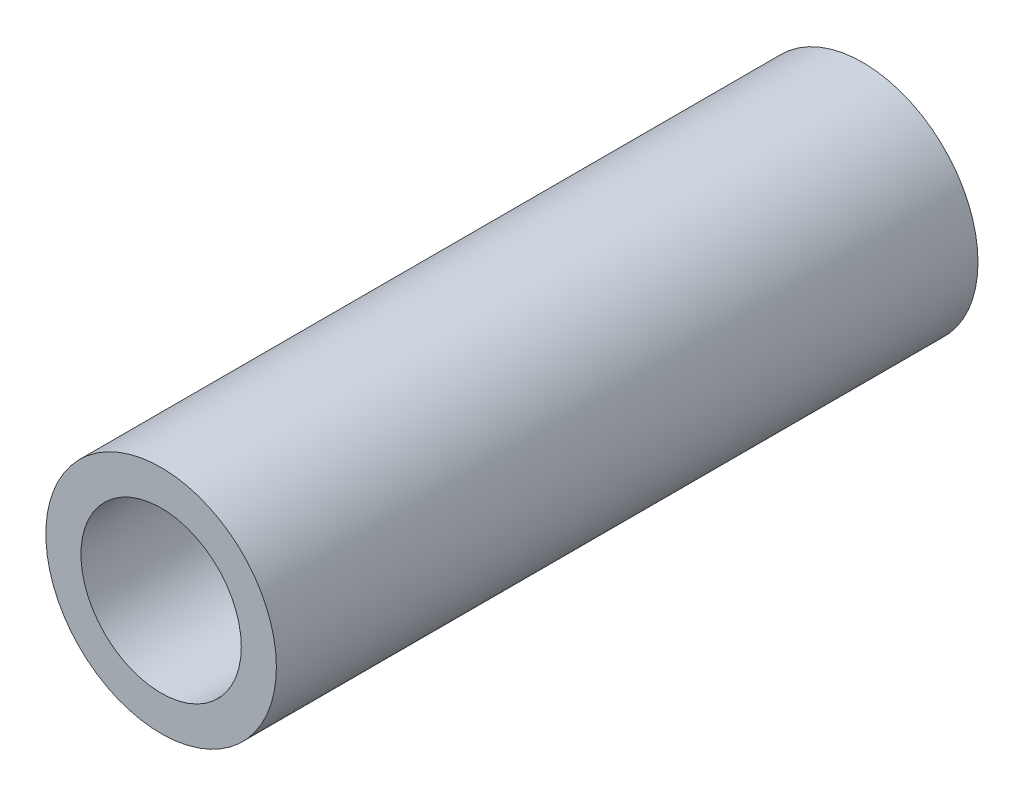
from build123d import *

# Parameters (mm, degrees)
SKETCH1_R           = 5.75
SKETCH1_R_2         = 4
BOSS_EXTRUDE1_DEPTH = 35


with BuildPart() as part:
    # Sketch1 → Boss-Extrude1 (new body)
    with BuildSketch(Plane.XY):
        Circle(SKETCH1_R)
        Circle(SKETCH1_R_2, mode=Mode.SUBTRACT)
    extrude(amount=BOSS_EXTRUDE1_DEPTH)


solid = part.part
